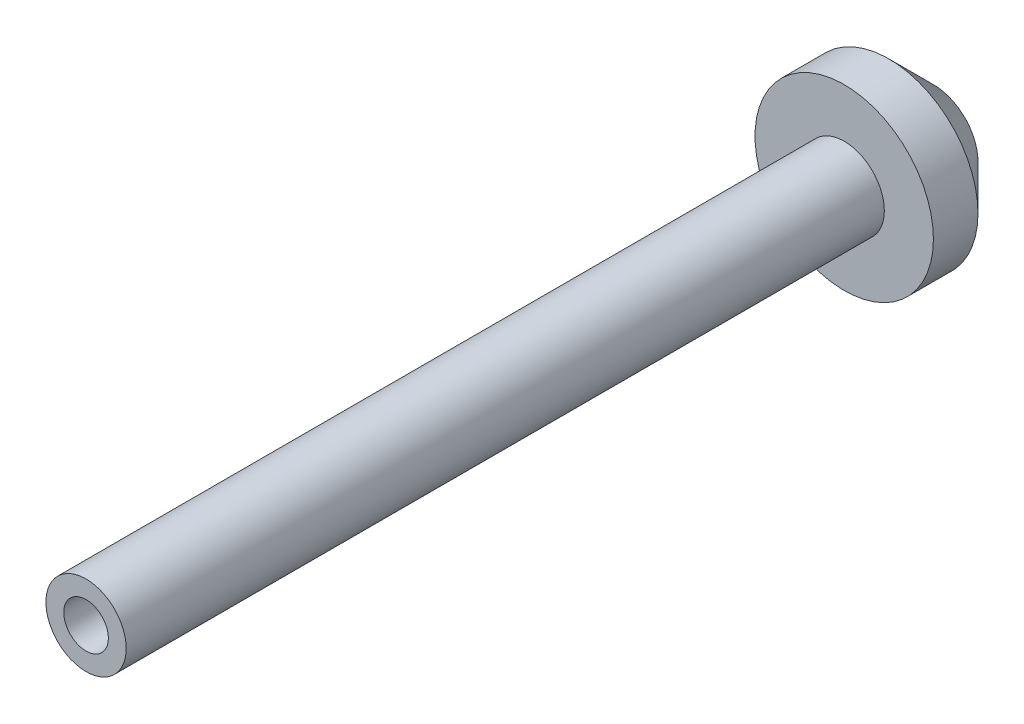
from build123d import *

# Parameters (mm, degrees)
SKETCH1_R           = 5
BOSS_EXTRUDE1_DEPTH = 5
SKETCH2_R           = 2.25
BOSS_EXTRUDE2_DEPTH = 42.5
SKETCH3_R           = 1.25
CUT_EXTRUDE1_DEPTH  = 10
CHAMFER1_SIZE       = 2.5


with BuildPart() as part:
    # Sketch1 → Boss-Extrude1 (new body)
    with BuildSketch(Plane.XY):
        Circle(SKETCH1_R)
    extrude(amount=BOSS_EXTRUDE1_DEPTH)

    # Sketch2 → Boss-Extrude2 (add)
    with BuildSketch(Plane.XY.offset(5)):
        Circle(SKETCH2_R)
    extrude(amount=BOSS_EXTRUDE2_DEPTH)

    # Sketch3 → Cut-Extrude1 (cut)
    with BuildSketch(Plane.XY.offset(47.5)):
        Circle(SKETCH3_R)
    extrude(amount=-CUT_EXTRUDE1_DEPTH, mode=Mode.SUBTRACT)

    # Chamfer1
    chamfer1_edges = [part.edges().sort_by_distance(p)[0] for p in [
        (-5, 0, 0),
    ]]
    chamfer(chamfer1_edges, length=CHAMFER1_SIZE)


solid = part.part
